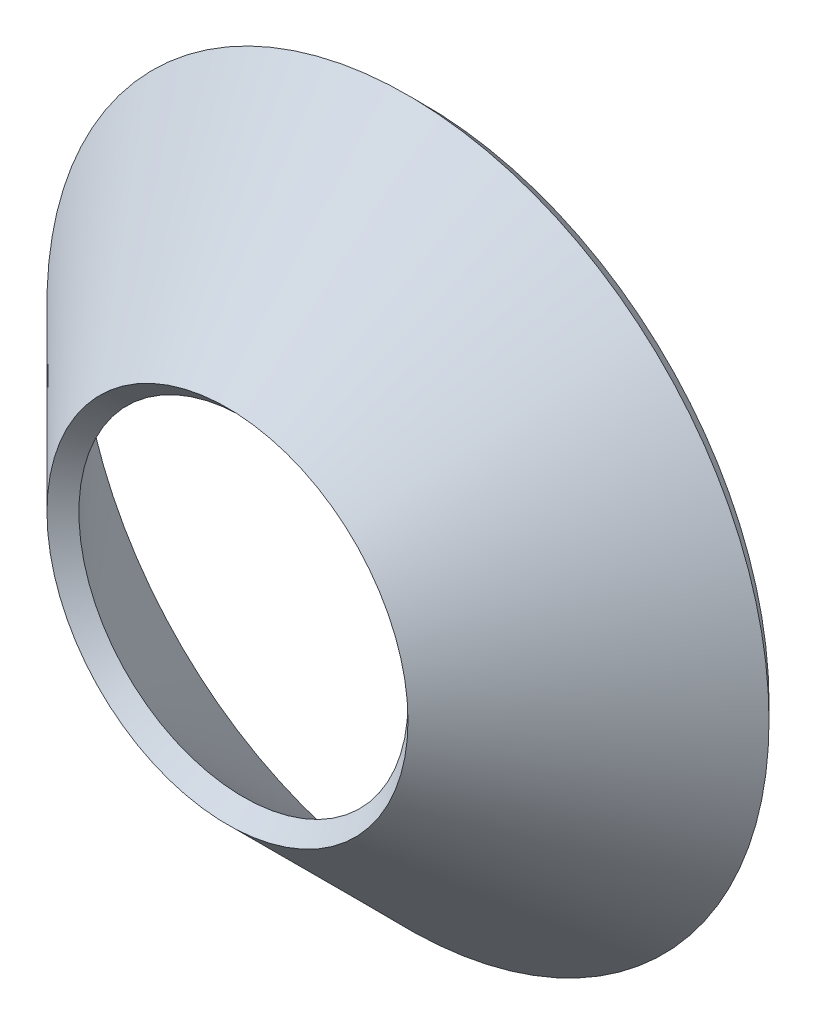
from build123d import *


with BuildPart() as part:
    # Sketch1 → Revolve-Thin1 (revolve)
    with BuildSketch(Plane.YZ, mode=Mode.PRIVATE) as revolve_thin1_sk:
        Polygon((25.4, 25.4), (50.8, 0), (48.55493597, -2.24506403), (23.15493597, 23.15493597), align=None)
    revolve(revolve_thin1_sk.sketch.rotate(Axis((0, 0, 26.67), (0, 0, -1)), 90), axis=Axis((0, 0, 26.67), (0, 0, -1)))


solid = part.part
